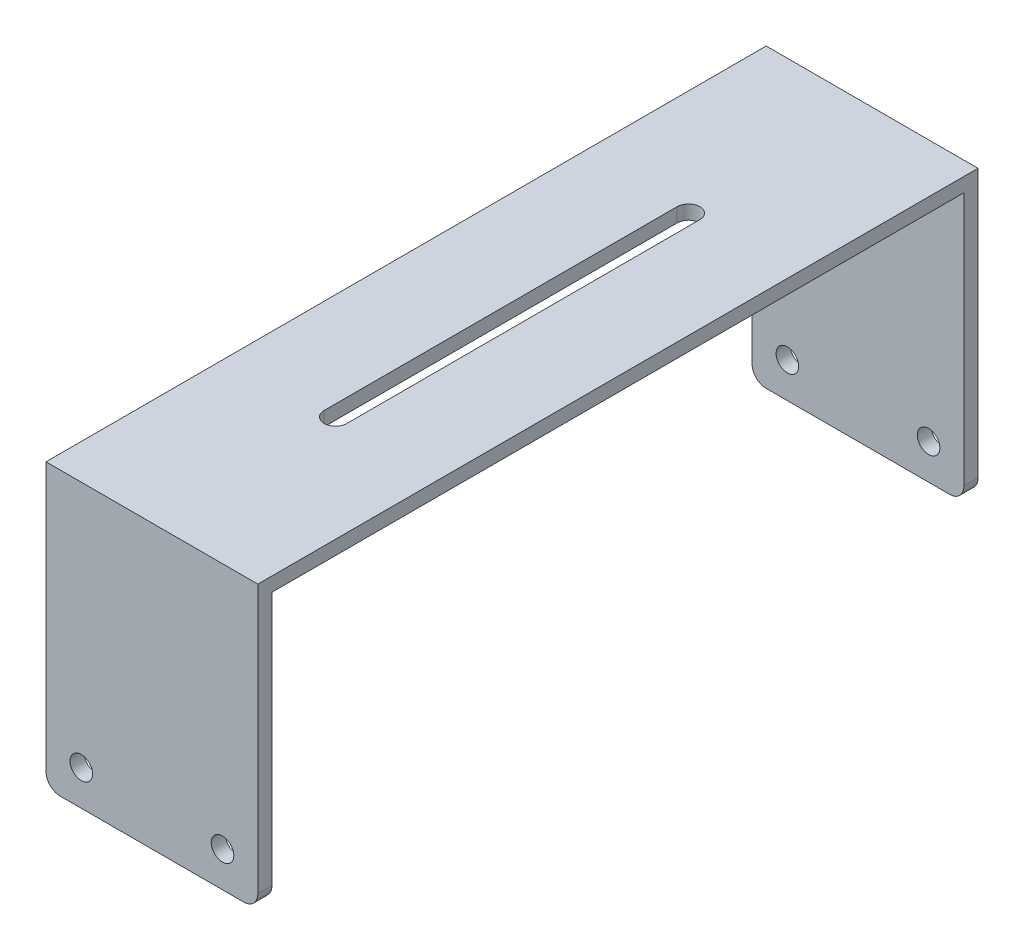
from build123d import *

# Parameters (mm, degrees)
SKETCH_1_W          = 30
SKETCH_1_H          = 40
SKETCH_1_R          = 1.6
EXTRUDE_1_DEPTH     = 2
SKETCH_3_W          = 30
SKETCH_3_H          = 2
EXTRUDE_2_DEPTH     = 100
SKETCH_5_W          = 30
SKETCH_5_H          = 2
EXTRUDE_4_DEPTH     = 38
SKETCH_6_R          = 1.6
CUT_EXTRUDE_1_DEPTH = 114.595774569
CUT_EXTRUDE_2_DEPTH = 2
FILLET_1_R          = 2


with BuildPart() as part:
    # 草图1 → 凸台-拉伸1 (new body)
    with BuildSketch(Plane.XY):
        with Locations((15, 20)):
            Rectangle(SKETCH_1_W, SKETCH_1_H)
        with Locations((5, 5)):
            Circle(SKETCH_1_R, mode=Mode.SUBTRACT)
        with Locations((25, 5)):
            Circle(SKETCH_1_R, mode=Mode.SUBTRACT)
    extrude(amount=EXTRUDE_1_DEPTH)

    # 草图3 → 凸台-拉伸2 (add)
    with BuildSketch(Plane(origin=(0, 0, 0), x_dir=(-1, 0, 0), z_dir=(0, 0, -1))):
        with Locations((-15, 39)):
            Rectangle(SKETCH_3_W, SKETCH_3_H)
    extrude(amount=EXTRUDE_2_DEPTH)

    # 草图5 → 凸台-拉伸4 (add)
    with BuildSketch(Plane.XZ.offset(-38)):
        with Locations((15, -99)):
            Rectangle(SKETCH_5_W, SKETCH_5_H)
    extrude(amount=EXTRUDE_4_DEPTH)

    # 草图6 → 切除-拉伸1 (cut, through all)
    with BuildSketch(Plane.XY.offset(2)):
        with Locations((5, 5)):
            Circle(SKETCH_6_R)
        with Locations((25, 5)):
            Circle(SKETCH_6_R)
    extrude(amount=-CUT_EXTRUDE_1_DEPTH, mode=Mode.SUBTRACT)

    # 草图7 → 切除-拉伸2 (cut)
    with BuildSketch(Plane(origin=(0, 40, 0), x_dir=(1, 0, 0), z_dir=(0, 1, 0))):
        with BuildLine():
            Line((13.4, 24), (13.4, 74))
            ThreePointArc((13.4, 74), (15, 75.6), (16.6, 74))
            Line((16.6, 74), (16.6, 24))
            ThreePointArc((16.6, 24), (15, 22.4), (13.4, 24))
        make_face()
    extrude(amount=-CUT_EXTRUDE_2_DEPTH, mode=Mode.SUBTRACT)

    # 圆角1
    fillet_1_edges = [part.edges().sort_by_distance(p)[0] for p in [
        (0, 0, -99),
        (30, 0, -99),
        (30, 0, 1),
        (0, 0, 1),
    ]]
    fillet(fillet_1_edges, radius=FILLET_1_R)


solid = part.part
